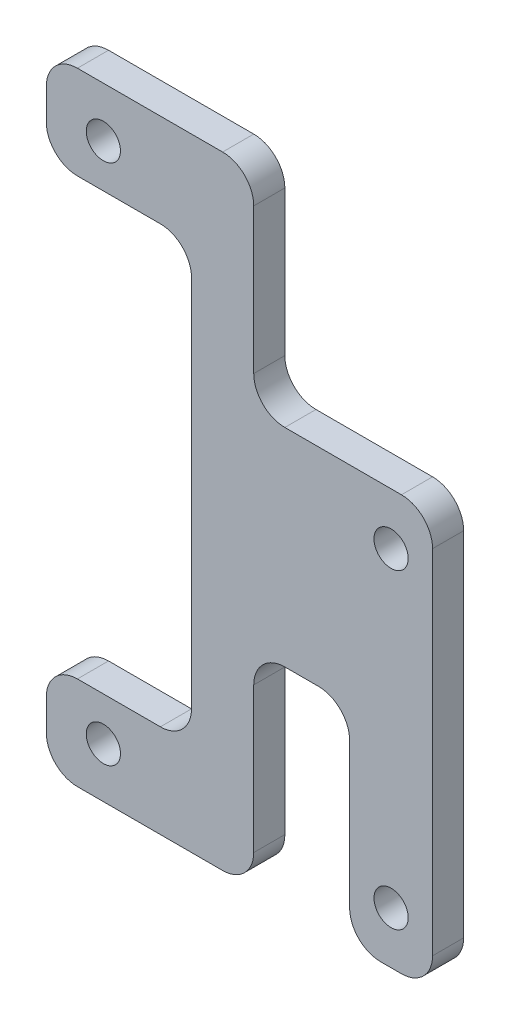
from build123d import *

# Parameters (mm, degrees)
SKETCH1_W           = 8
SKETCH1_H           = 40
SKETCH1_R           = 1.65
BOSS_EXTRUDE1_DEPTH = 3
SKETCH9_W           = 3
SKETCH9_H           = 20
BOSS_EXTRUDE6_DEPTH = 9.245
SKETCH10_W          = 3
SKETCH10_H          = 60
BOSS_EXTRUDE7_DEPTH = 20
SKETCH11_W          = 14
SKETCH11_H          = 42
CUT_EXTRUDE1_DEPTH  = 10
SKETCH12_R          = 1.65
CUT_EXTRUDE2_DEPTH  = 10
FILLET7_R           = 3


with BuildPart() as part:
    # Sketch1 → Boss-Extrude1 (new body)
    with BuildSketch(Plane.XY):
        Rectangle(SKETCH1_W, SKETCH1_H)
        with Locations((0, 15)):
            Circle(SKETCH1_R, mode=Mode.SUBTRACT)
        with Locations(Location((0, -15, 0), (0, 0, 180))):
            Circle(SKETCH1_R, mode=Mode.SUBTRACT)
    extrude(amount=BOSS_EXTRUDE1_DEPTH)

    # Sketch9 → Boss-Extrude6 (add)
    with BuildSketch(Plane.ZY.offset(4)):
        with Locations((1.5, 10)):
            Rectangle(SKETCH9_W, SKETCH9_H)
    extrude(amount=BOSS_EXTRUDE6_DEPTH)

    # Sketch10 → Boss-Extrude7 (add)
    with BuildSketch(Plane.ZY.offset(13.245)):
        with Locations((1.5, 10)):
            Rectangle(SKETCH10_W, SKETCH10_H)
    extrude(amount=BOSS_EXTRUDE7_DEPTH)

    # Sketch11 → Cut-Extrude1 (cut)
    with BuildSketch(Plane.XY.offset(3)):
        with Locations((-26.245, 10)):
            Rectangle(SKETCH11_W, SKETCH11_H)
    extrude(amount=-CUT_EXTRUDE1_DEPTH, mode=Mode.SUBTRACT)

    # Sketch12 → Cut-Extrude2 (cut)
    with BuildSketch(Plane.XY.offset(3)):
        with Locations((-27.745, 35.17)):
            Circle(SKETCH12_R)
        with Locations((-27.745, -15.17)):
            Circle(SKETCH12_R)
    extrude(amount=-CUT_EXTRUDE2_DEPTH, mode=Mode.SUBTRACT)

    # Fillet7
    fillet7_edges = [part.edges().sort_by_distance(p)[0] for p in [
        (-4, 0, 1.5),
        (-13.245, 0, 1.5),
        (-13.245, 20, 1.5),
        (-13.245, 40, 1.5),
        (-13.245, -20, 1.5),
        (-33.245, 40, 1.5),
        (-33.245, -20, 1.5),
        (-33.245, -11, 1.5),
        (-33.245, 31, 1.5),
        (-19.245, 31, 1.5),
        (-19.245, -11, 1.5),
        (4, -20, 1.5),
        (-4, -20, 1.5),
        (4, 20, 1.5),
    ]]
    fillet(fillet7_edges, radius=FILLET7_R)


solid = part.part
